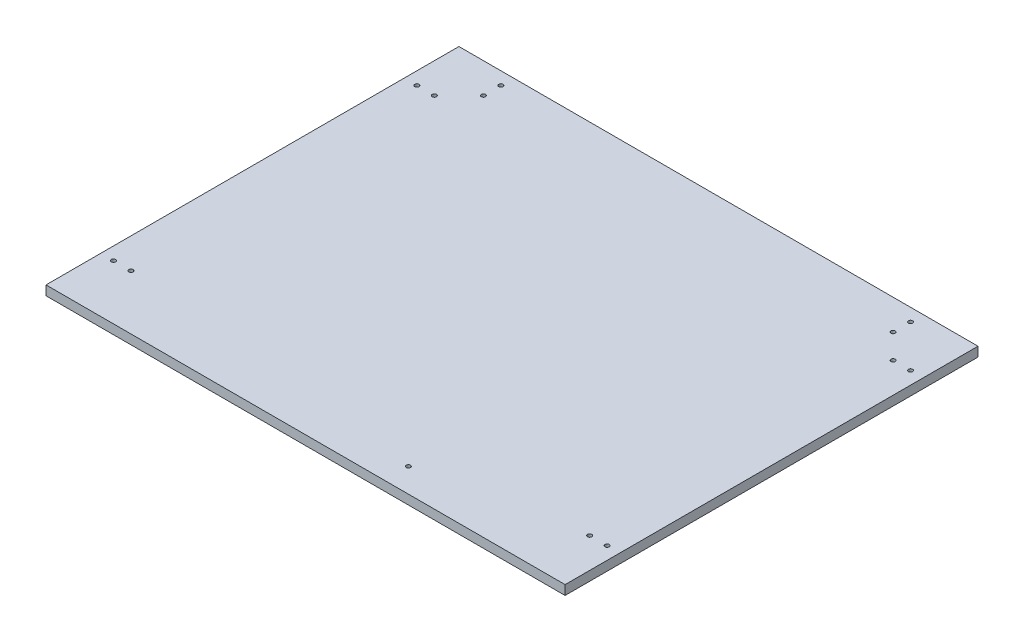
from build123d import *

# Parameters (mm, degrees)
SCHIZZO1_W                   = 550
SCHIZZO1_H                   = 437.5
ESTRUSIONE_ESTRUSIONE1_DEPTH = 10
SCHIZZO2_R                   = 2.25
TAGLIO_ESTRUSIONE1_DEPTH     = 10


with BuildPart() as part:
    # Schizzo1 → Estrusione-Estrusione1 (new body)
    with BuildSketch(Plane(origin=(0, 0, 0), x_dir=(1, 0, 0), z_dir=(0, 1, 0))):
        Rectangle(SCHIZZO1_W, SCHIZZO1_H)
    extrude(amount=ESTRUSIONE_ESTRUSIONE1_DEPTH)

    # Schizzo2 → Taglio-Estrusione1 (cut)
    with BuildSketch(Plane(origin=(0, 0, 0), x_dir=(-1, 0, 0), z_dir=(0, -1, 0))):
        with Locations(Location((-217, 205.25, 0), (0, 0, 90))):
            Circle(SCHIZZO2_R)
        with Locations(Location((-217, 186.75, 0), (0, 0, 90))):
            Circle(SCHIZZO2_R)
        with Locations(Location((-243, 160.75, 0), (0, 0, 90))):
            Circle(SCHIZZO2_R)
        with Locations(Location((-261.5, 160.75, 0), (0, 0, 90))):
            Circle(SCHIZZO2_R)
        with Locations(Location((217, 205.25, 0), (0, 0, 90))):
            Circle(SCHIZZO2_R)
        with Locations(Location((217, 186.75, 0), (0, 0, 90))):
            Circle(SCHIZZO2_R)
        with Locations(Location((243, 160.75, 0), (0, 0, 90))):
            Circle(SCHIZZO2_R)
        with Locations(Location((261.5, 160.75, 0), (0, 0, 90))):
            Circle(SCHIZZO2_R)
        with Locations(Location((261.5, -160.75, 0), (0, 0, 90))):
            Circle(SCHIZZO2_R)
        with Locations(Location((243, -160.75, 0), (0, 0, 90))):
            Circle(SCHIZZO2_R)
        with Locations(Location((-261.5, -160.75, 0), (0, 0, 90))):
            Circle(SCHIZZO2_R)
        with Locations(Location((-243, -160.75, 0), (0, 0, 90))):
            Circle(SCHIZZO2_R)
        with Locations(Location((-83.5, -193.25, 0), (0, 0, 90))):
            Circle(SCHIZZO2_R)
    extrude(amount=-TAGLIO_ESTRUSIONE1_DEPTH, mode=Mode.SUBTRACT)


solid = part.part
